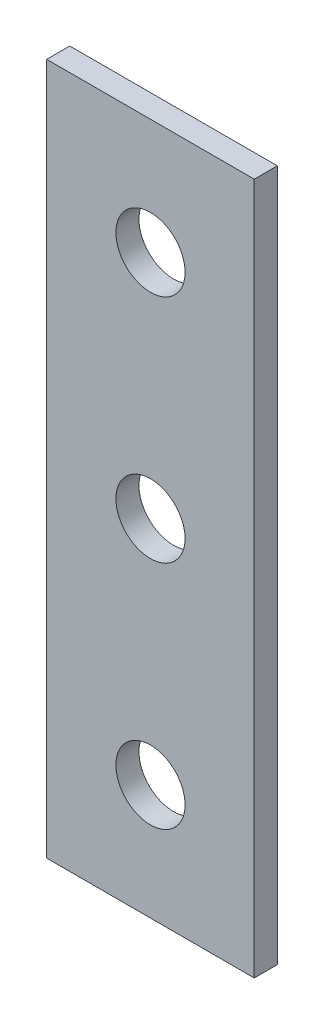
from build123d import *

# Parameters (mm, degrees)
CROQUIS1_W              = 9
CROQUIS1_H              = 30
CROQUIS1_R              = 1.5
SALIENTE_EXTRUIR1_DEPTH = 1


with BuildPart() as part:
    # Croquis1 → Saliente-Extruir1 (new body)
    with BuildSketch(Plane.XY):
        with Locations((4.5, 15)):
            Rectangle(CROQUIS1_W, CROQUIS1_H)
        with Locations((4.5, 25)):
            Circle(CROQUIS1_R, mode=Mode.SUBTRACT)
        with Locations((4.5, 15)):
            Circle(CROQUIS1_R, mode=Mode.SUBTRACT)
        with Locations((4.5, 5)):
            Circle(CROQUIS1_R, mode=Mode.SUBTRACT)
    extrude(amount=SALIENTE_EXTRUIR1_DEPTH)


solid = part.part
